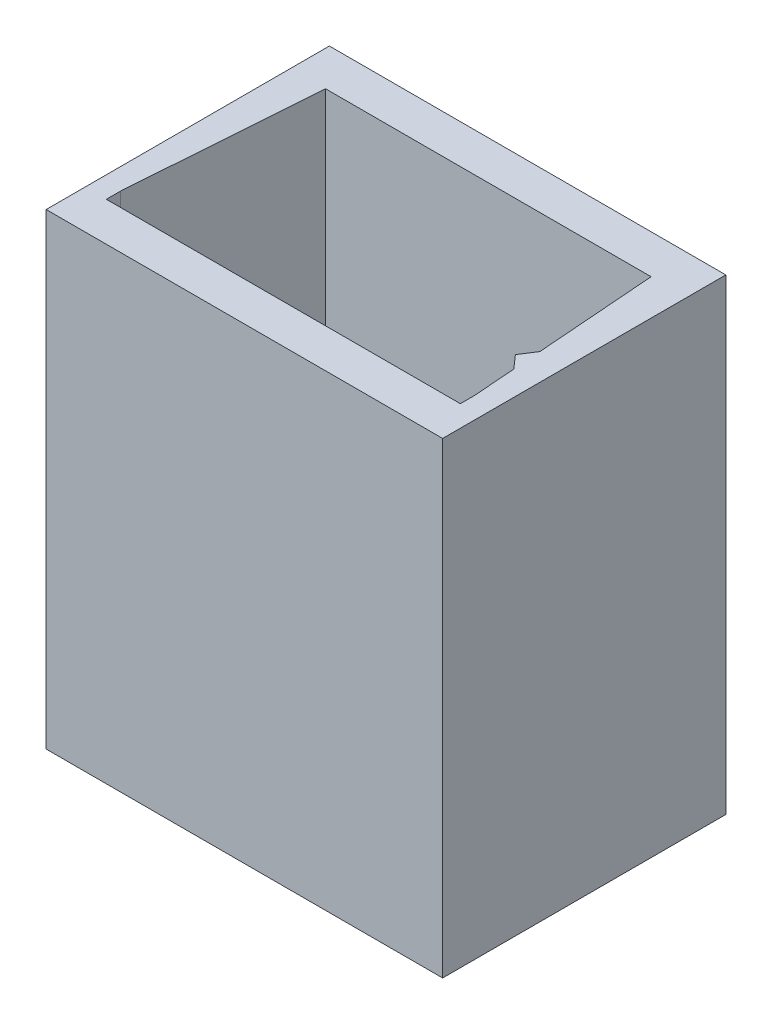
from build123d import *

# Parameters (mm, degrees)
ESBO_O1_W                 = 56
ESBO_O1_H                 = 40
RESSALTO_EXTRUS_O1_DEPTH  = 66
CORTE_EXTRUS_O1_DEPTH     = 61
ESBO_O10_W                = 53.4
ESBO_O10_H                = 37.4
CORTE_EXTRUS_O2_DEPTH     = 2.2
ESBO_O11_R                = 3.255
ESBO_O11_R_2              = 2.4
RESSALTO_EXTRUS_O11_DEPTH = 2.2
ESBO_O14_W                = 1
ESBO_O14_H                = 1.6
RESSALTO_EXTRUS_O13_DEPTH = 2.2
ESBO_O15_W                = 1.6
ESBO_O15_H                = 1
RESSALTO_EXTRUS_O14_DEPTH = 2.2


with BuildPart() as part:
    # Esboço1 → Ressalto-extrusão1 (new body)
    with BuildSketch(Plane(origin=(0, 0, 0), x_dir=(1, 0, 0), z_dir=(0, 1, 0))):
        Rectangle(ESBO_O1_W, ESBO_O1_H)
    extrude(amount=RESSALTO_EXTRUS_O1_DEPTH)

    # Esboço2 → Corte-extrusão1 (cut)
    with BuildSketch(Plane(origin=(0, 66, 0), x_dir=(1, 0, 0), z_dir=(0, 1, 0))):
        Polygon((-25, -14.5), (25, -14.5), (25, -12.5), (24.543239024, -6.497353133), (22.894596582, -4.617997365), (24.239890958, -2.510823181), (22.945481945, 14.5), (-23.054518055, 14.5), (-25, -12.5), align=None)
    extrude(amount=-CORTE_EXTRUS_O1_DEPTH, mode=Mode.SUBTRACT)

    # Esboço10 → Corte-extrusão2 (cut)
    with BuildSketch(Plane.XZ):
        Rectangle(ESBO_O10_W, ESBO_O10_H)
    extrude(amount=-CORTE_EXTRUS_O2_DEPTH, mode=Mode.SUBTRACT)

    # Esboço11 → Ressalto-extrusão11 (add)
    # profile 1 of 24: a face of its own
    with BuildSketch(Plane(origin=(0, 2.2, 0), x_dir=(-1, 0, 0), z_dir=(0, -1, 0))):
        with Locations(Location((20, -12, 0), (0, 0, 270))):
            Circle(ESBO_O11_R)
        with Locations(Location((20, -12, 0), (0, 0, 270))):
            Circle(ESBO_O11_R_2, mode=Mode.SUBTRACT)
    # profile 2 of 24: a face of its own
    with BuildSketch(Plane(origin=(0, 2.2, 0), x_dir=(-1, 0, 0), z_dir=(0, -1, 0))):
        with Locations(Location((12, -12, 0), (0, 0, 270))):
            Circle(ESBO_O11_R)
        with Locations(Location((12, -12, 0), (0, 0, 270))):
            Circle(ESBO_O11_R_2, mode=Mode.SUBTRACT)
    # profile 3 of 24: a face of its own
    with BuildSketch(Plane(origin=(0, 2.2, 0), x_dir=(-1, 0, 0), z_dir=(0, -1, 0))):
        with Locations(Location((20, -4, 0), (0, 0, 270))):
            Circle(ESBO_O11_R)
        with Locations(Location((20, -4, 0), (0, 0, 270))):
            Circle(ESBO_O11_R_2, mode=Mode.SUBTRACT)
    # profile 4 of 24: a face of its own
    with BuildSketch(Plane(origin=(0, 2.2, 0), x_dir=(-1, 0, 0), z_dir=(0, -1, 0))):
        with Locations(Location((12, -4, 0), (0, 0, 270))):
            Circle(ESBO_O11_R)
        with Locations(Location((12, -4, 0), (0, 0, 270))):
            Circle(ESBO_O11_R_2, mode=Mode.SUBTRACT)
    # profile 5 of 24: a face of its own
    with BuildSketch(Plane(origin=(0, 2.2, 0), x_dir=(-1, 0, 0), z_dir=(0, -1, 0))):
        with Locations(Location((20, 4, 0), (0, 0, 270))):
            Circle(ESBO_O11_R)
        with Locations(Location((20, 4, 0), (0, 0, 270))):
            Circle(ESBO_O11_R_2, mode=Mode.SUBTRACT)
    # profile 6 of 24: a face of its own
    with BuildSketch(Plane(origin=(0, 2.2, 0), x_dir=(-1, 0, 0), z_dir=(0, -1, 0))):
        with Locations(Location((12, 4, 0), (0, 0, 270))):
            Circle(ESBO_O11_R)
        with Locations(Location((12, 4, 0), (0, 0, 270))):
            Circle(ESBO_O11_R_2, mode=Mode.SUBTRACT)
    # profile 7 of 24: a face of its own
    with BuildSketch(Plane(origin=(0, 2.2, 0), x_dir=(-1, 0, 0), z_dir=(0, -1, 0))):
        with Locations(Location((20, 12, 0), (0, 0, 270))):
            Circle(ESBO_O11_R)
        with Locations(Location((20, 12, 0), (0, 0, 270))):
            Circle(ESBO_O11_R_2, mode=Mode.SUBTRACT)
    # profile 8 of 24: a face of its own
    with BuildSketch(Plane(origin=(0, 2.2, 0), x_dir=(-1, 0, 0), z_dir=(0, -1, 0))):
        with Locations(Location((12, 12, 0), (0, 0, 270))):
            Circle(ESBO_O11_R)
        with Locations(Location((12, 12, 0), (0, 0, 270))):
            Circle(ESBO_O11_R_2, mode=Mode.SUBTRACT)
    # profile 9 of 24: a face of its own
    with BuildSketch(Plane(origin=(0, 2.2, 0), x_dir=(-1, 0, 0), z_dir=(0, -1, 0))):
        with Locations(Location((4, -12, 0), (0, 0, 270))):
            Circle(ESBO_O11_R)
        with Locations(Location((4, -12, 0), (0, 0, 270))):
            Circle(ESBO_O11_R_2, mode=Mode.SUBTRACT)
    # profile 10 of 24: a face of its own
    with BuildSketch(Plane(origin=(0, 2.2, 0), x_dir=(-1, 0, 0), z_dir=(0, -1, 0))):
        with Locations(Location((-4, -12, 0), (0, 0, 270))):
            Circle(ESBO_O11_R)
        with Locations(Location((-4, -12, 0), (0, 0, 270))):
            Circle(ESBO_O11_R_2, mode=Mode.SUBTRACT)
    # profile 11 of 24: a face of its own
    with BuildSketch(Plane(origin=(0, 2.2, 0), x_dir=(-1, 0, 0), z_dir=(0, -1, 0))):
        with Locations(Location((-12, -12, 0), (0, 0, 270))):
            Circle(ESBO_O11_R)
        with Locations(Location((-12, -12, 0), (0, 0, 270))):
            Circle(ESBO_O11_R_2, mode=Mode.SUBTRACT)
    # profile 12 of 24: a face of its own
    with BuildSketch(Plane(origin=(0, 2.2, 0), x_dir=(-1, 0, 0), z_dir=(0, -1, 0))):
        with Locations(Location((-20, -12, 0), (0, 0, 270))):
            Circle(ESBO_O11_R)
        with Locations(Location((-20, -12, 0), (0, 0, 270))):
            Circle(ESBO_O11_R_2, mode=Mode.SUBTRACT)
    # profile 13 of 24: a face of its own
    with BuildSketch(Plane(origin=(0, 2.2, 0), x_dir=(-1, 0, 0), z_dir=(0, -1, 0))):
        with Locations(Location((4, -4, 0), (0, 0, 270))):
            Circle(ESBO_O11_R)
        with Locations(Location((4, -4, 0), (0, 0, 270))):
            Circle(ESBO_O11_R_2, mode=Mode.SUBTRACT)
    # profile 14 of 24: a face of its own
    with BuildSketch(Plane(origin=(0, 2.2, 0), x_dir=(-1, 0, 0), z_dir=(0, -1, 0))):
        with Locations(Location((-4, -4, 0), (0, 0, 270))):
            Circle(ESBO_O11_R)
        with Locations(Location((-4, -4, 0), (0, 0, 270))):
            Circle(ESBO_O11_R_2, mode=Mode.SUBTRACT)
    # profile 15 of 24: a face of its own
    with BuildSketch(Plane(origin=(0, 2.2, 0), x_dir=(-1, 0, 0), z_dir=(0, -1, 0))):
        with Locations(Location((-12, -4, 0), (0, 0, 270))):
            Circle(ESBO_O11_R)
        with Locations(Location((-12, -4, 0), (0, 0, 270))):
            Circle(ESBO_O11_R_2, mode=Mode.SUBTRACT)
    # profile 16 of 24: a face of its own
    with BuildSketch(Plane(origin=(0, 2.2, 0), x_dir=(-1, 0, 0), z_dir=(0, -1, 0))):
        with Locations(Location((-20, -4, 0), (0, 0, 270))):
            Circle(ESBO_O11_R)
        with Locations(Location((-20, -4, 0), (0, 0, 270))):
            Circle(ESBO_O11_R_2, mode=Mode.SUBTRACT)
    # profile 17 of 24: a face of its own
    with BuildSketch(Plane(origin=(0, 2.2, 0), x_dir=(-1, 0, 0), z_dir=(0, -1, 0))):
        with Locations(Location((4, 4, 0), (0, 0, 270))):
            Circle(ESBO_O11_R)
        with Locations(Location((4, 4, 0), (0, 0, 270))):
            Circle(ESBO_O11_R_2, mode=Mode.SUBTRACT)
    # profile 18 of 24: a face of its own
    with BuildSketch(Plane(origin=(0, 2.2, 0), x_dir=(-1, 0, 0), z_dir=(0, -1, 0))):
        with Locations(Location((-4, 4, 0), (0, 0, 270))):
            Circle(ESBO_O11_R)
        with Locations(Location((-4, 4, 0), (0, 0, 270))):
            Circle(ESBO_O11_R_2, mode=Mode.SUBTRACT)
    # profile 19 of 24: a face of its own
    with BuildSketch(Plane(origin=(0, 2.2, 0), x_dir=(-1, 0, 0), z_dir=(0, -1, 0))):
        with Locations(Location((-12, 4, 0), (0, 0, 270))):
            Circle(ESBO_O11_R)
        with Locations(Location((-12, 4, 0), (0, 0, 270))):
            Circle(ESBO_O11_R_2, mode=Mode.SUBTRACT)
    # profile 20 of 24: a face of its own
    with BuildSketch(Plane(origin=(0, 2.2, 0), x_dir=(-1, 0, 0), z_dir=(0, -1, 0))):
        with Locations(Location((-20, 4, 0), (0, 0, 270))):
            Circle(ESBO_O11_R)
        with Locations(Location((-20, 4, 0), (0, 0, 270))):
            Circle(ESBO_O11_R_2, mode=Mode.SUBTRACT)
    # profile 21 of 24: a face of its own
    with BuildSketch(Plane(origin=(0, 2.2, 0), x_dir=(-1, 0, 0), z_dir=(0, -1, 0))):
        with Locations(Location((4, 12, 0), (0, 0, 270))):
            Circle(ESBO_O11_R)
        with Locations(Location((4, 12, 0), (0, 0, 270))):
            Circle(ESBO_O11_R_2, mode=Mode.SUBTRACT)
    # profile 22 of 24: a face of its own
    with BuildSketch(Plane(origin=(0, 2.2, 0), x_dir=(-1, 0, 0), z_dir=(0, -1, 0))):
        with Locations(Location((-4, 12, 0), (0, 0, 270))):
            Circle(ESBO_O11_R)
        with Locations(Location((-4, 12, 0), (0, 0, 270))):
            Circle(ESBO_O11_R_2, mode=Mode.SUBTRACT)
    # profile 23 of 24: a face of its own
    with BuildSketch(Plane(origin=(0, 2.2, 0), x_dir=(-1, 0, 0), z_dir=(0, -1, 0))):
        with Locations(Location((-12, 12, 0), (0, 0, 270))):
            Circle(ESBO_O11_R)
        with Locations(Location((-12, 12, 0), (0, 0, 270))):
            Circle(ESBO_O11_R_2, mode=Mode.SUBTRACT)
    # profile 24 of 24: a face of its own
    with BuildSketch(Plane(origin=(0, 2.2, 0), x_dir=(-1, 0, 0), z_dir=(0, -1, 0))):
        with Locations(Location((-20, 12, 0), (0, 0, 270))):
            Circle(ESBO_O11_R)
        with Locations(Location((-20, 12, 0), (0, 0, 270))):
            Circle(ESBO_O11_R_2, mode=Mode.SUBTRACT)
    extrude(amount=RESSALTO_EXTRUS_O11_DEPTH)

    # Esboço14 → Ressalto-extrusão13 (add)
    with BuildSketch(Plane.XZ.offset(-2.2)):
        with Locations((-24, 19.2)):
            Rectangle(ESBO_O14_W, ESBO_O14_H)
        with Locations((-16, 19.2)):
            Rectangle(ESBO_O14_W, ESBO_O14_H)
        with Locations((-8, 19.2)):
            Rectangle(ESBO_O14_W, ESBO_O14_H)
        with Locations((0, 19.2)):
            Rectangle(ESBO_O14_W, ESBO_O14_H)
        with Locations((8, 19.2)):
            Rectangle(ESBO_O14_W, ESBO_O14_H)
        with Locations((16, 19.2)):
            Rectangle(ESBO_O14_W, ESBO_O14_H)
        with Locations((24, 19.2)):
            Rectangle(ESBO_O14_W, ESBO_O14_H)
        with Locations((-16, -19.2)):
            Rectangle(ESBO_O14_W, ESBO_O14_H)
        with Locations((-8, -19.2)):
            Rectangle(ESBO_O14_W, ESBO_O14_H)
        with Locations((0, -19.2)):
            Rectangle(ESBO_O14_W, ESBO_O14_H)
        with Locations((8, -19.2)):
            Rectangle(ESBO_O14_W, ESBO_O14_H)
        with Locations((16, -19.2)):
            Rectangle(ESBO_O14_W, ESBO_O14_H)
        with Locations((24, -19.2)):
            Rectangle(ESBO_O14_W, ESBO_O14_H)
        with Locations((-24, -19.2)):
            Rectangle(ESBO_O14_W, ESBO_O14_H)
    extrude(amount=RESSALTO_EXTRUS_O13_DEPTH)

    # Esboço15 → Ressalto-extrusão14 (add)
    with BuildSketch(Plane.XZ.offset(-2.2)):
        with Locations((-27.2, 16)):
            Rectangle(ESBO_O15_W, ESBO_O15_H)
        with Locations((27.2, 16)):
            Rectangle(ESBO_O15_W, ESBO_O15_H)
        with Locations((27.2, 8)):
            Rectangle(ESBO_O15_W, ESBO_O15_H)
        with Locations((27.2, 0)):
            Rectangle(ESBO_O15_W, ESBO_O15_H)
        with Locations((27.2, -8)):
            Rectangle(ESBO_O15_W, ESBO_O15_H)
        with Locations((27.2, -16)):
            Rectangle(ESBO_O15_W, ESBO_O15_H)
        with Locations((-27.2, 8)):
            Rectangle(ESBO_O15_W, ESBO_O15_H)
        with Locations((-27.2, 0)):
            Rectangle(ESBO_O15_W, ESBO_O15_H)
        with Locations((-27.2, -8)):
            Rectangle(ESBO_O15_W, ESBO_O15_H)
        with Locations((-27.2, -16)):
            Rectangle(ESBO_O15_W, ESBO_O15_H)
    extrude(amount=RESSALTO_EXTRUS_O14_DEPTH)


solid = part.part
